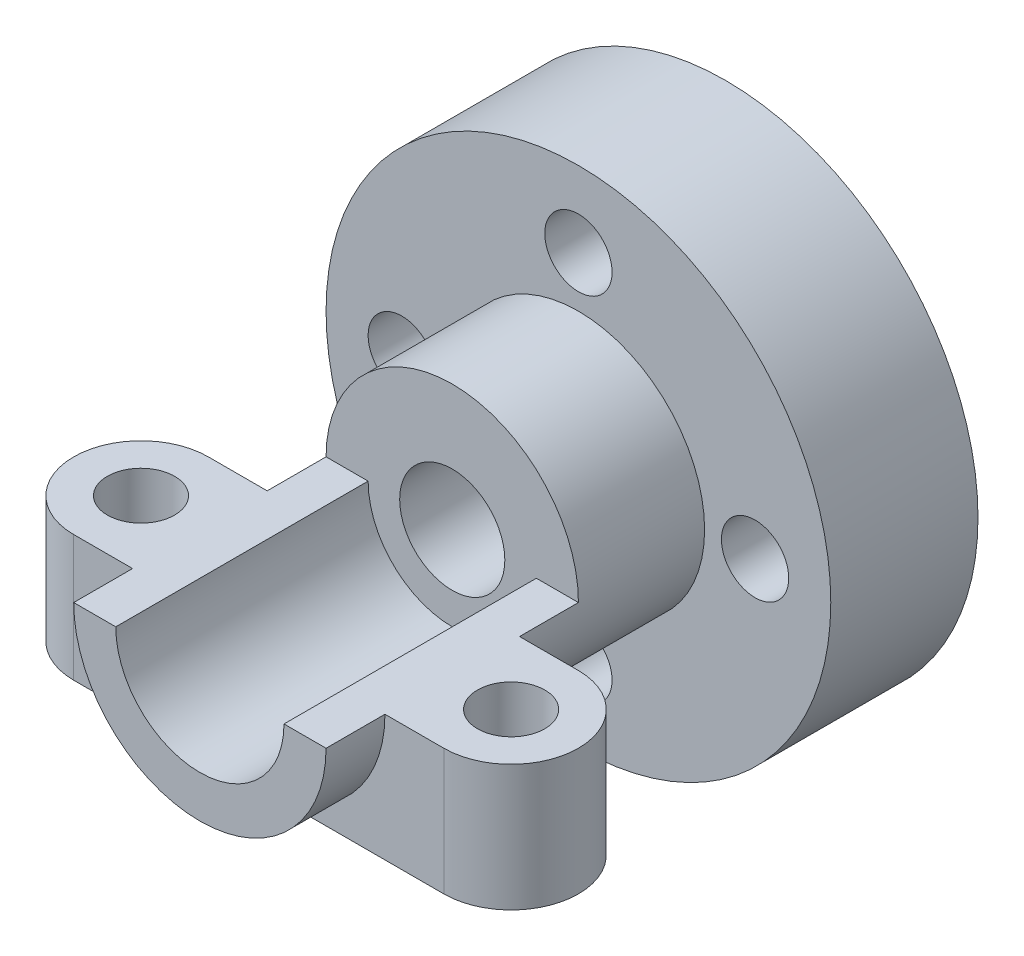
from build123d import *

# Parameters (mm, degrees)
BOSS_EXTRUDE1_DEPTH         = 125
SKETCH1_3_R                 = 12.5
BOSS_EXTRUDE2_DEPTH         = 65
SKETCH1_4_R                 = 60
SKETCH1_4_R_2               = 8
SKETCH1_4_R_3               = 30
BOSS_EXTRUDE3_DEPTH         = 35
BOSS_EXTRUDE4_START         = -46
BOSS_EXTRUDE4_DEPTH         = 32
FILLET1_RADIUS              = 16
FILLET1_LENGTH              = 30
F_16_0MM_DOWEL_HOLE1_D      = 16
FILLET1_OF_MIRROR1_2_RADIUS = 16
FILLET1_OF_MIRROR1_2_LENGTH = 30
SKETCH4_R                   = 55
CUT_EXTRUDE1_DEPTH          = 15


with BuildPart() as part:
    # Sketch1 → Boss-Extrude1 (new body)
    with BuildSketch(Plane.XY):
        with BuildLine():
            ThreePointArc((20, 0), (0, -20), (-20, 0))
            Line((-20, 0), (-30, 0))
            ThreePointArc((-30, 0), (0, -30), (30, 0))
            Line((30, 0), (20, 0))
        make_face()
    extrude(amount=BOSS_EXTRUDE1_DEPTH)

    # Sketch1<3> → Boss-Extrude2 (add)
    with BuildSketch(Plane.XY):
        with BuildLine():
            Line((-30, 0), (-20, 0))
            ThreePointArc((-20, 0), (0, -20), (20, 0))
            Line((20, 0), (30, 0))
            ThreePointArc((30, 0), (0, 30), (-30, 0))
        make_face()
        Circle(SKETCH1_3_R, mode=Mode.SUBTRACT)
    extrude(amount=BOSS_EXTRUDE2_DEPTH)

    # Sketch1<4> → Boss-Extrude3 (add)
    with BuildSketch(Plane.XY):
        Circle(SKETCH1_4_R)
        with Locations((0, 42)):
            Circle(SKETCH1_4_R_2, mode=Mode.SUBTRACT)
        with Locations((-42, 0)):
            Circle(SKETCH1_4_R_2, mode=Mode.SUBTRACT)
        with Locations((0, -42)):
            Circle(SKETCH1_4_R_2, mode=Mode.SUBTRACT)
        with Locations((42, 0)):
            Circle(SKETCH1_4_R_2, mode=Mode.SUBTRACT)
        Circle(SKETCH1_4_R_3, mode=Mode.SUBTRACT)
    extrude(amount=BOSS_EXTRUDE3_DEPTH)

    # Sketch2 → Boss-Extrude4 (add)
    with BuildSketch(Plane.XY.offset(125).offset(BOSS_EXTRUDE4_START)):
        with BuildLine():
            Line((60, 0), (30, 0))
            ThreePointArc((30, 0), (21.213203436, -21.213203436), (0, -30))
            Line((0, -30), (60, -30))
            Line((60, -30), (60, 0))
        make_face()
    boss_extrude4 = extrude(amount=BOSS_EXTRUDE4_DEPTH)

    # Fillet1: full round fillet: the end face becomes a half cylinder, R = half its width
    fillet1_face = Plane((60, -15, 95), x_dir=(0, -1, 0), z_dir=(1, 0, 0))  # on the end face: x along it, z out of the body
    fillet1_slab = fillet1_face.offset(-FILLET1_RADIUS / 2) * Box(FILLET1_LENGTH, 2 * FILLET1_RADIUS, FILLET1_RADIUS, mode=Mode.PRIVATE)  # the body's end, R deep
    fillet1_round = Plane((44, -15, 95), x_dir=(1, 0, 0), z_dir=(0, -1, 0)) * Cylinder(FILLET1_RADIUS, FILLET1_LENGTH, mode=Mode.PRIVATE)  # its axis R under the face
    add(fillet1_slab - fillet1_round, mode=Mode.SUBTRACT)

    # Ø16.0mm Dowel Hole1 (through all)
    with Locations(Plane(origin=(44, 0, 95), x_dir=(0, 0, 1), z_dir=(0, 1, 0))):
        with Locations((0, 0)):
            f_16_0mm_dowel_hole1 = Hole(F_16_0MM_DOWEL_HOLE1_D / 2)

    # Mirror1: Boss-Extrude4, Ø16.0mm Dowel Hole1 across plane
    add(boss_extrude4.mirror(Plane(origin=(0, 0, 0), x_dir=(0, 0, 1), z_dir=(1, 0, 0))))
    add(f_16_0mm_dowel_hole1.mirror(Plane(origin=(0, 0, 0), x_dir=(0, 0, 1), z_dir=(1, 0, 0))), mode=Mode.SUBTRACT)

    # Fillet1 of Mirror1 2: full round fillet: the end face becomes a half cylinder, R = half its width
    fillet1_of_mirror1_2_face = Plane((-60, -15, 95), x_dir=(0, -1, 0), z_dir=(-1, 0, 0))  # on the end face: x along it, z out of the body
    fillet1_of_mirror1_2_slab = fillet1_of_mirror1_2_face.offset(-FILLET1_OF_MIRROR1_2_RADIUS / 2) * Box(FILLET1_OF_MIRROR1_2_LENGTH, 2 * FILLET1_OF_MIRROR1_2_RADIUS, FILLET1_OF_MIRROR1_2_RADIUS, mode=Mode.PRIVATE)  # the body's end, R deep
    fillet1_of_mirror1_2_round = Plane((-44, -15, 95), x_dir=(-1, 0, 0), z_dir=(0, -1, 0)) * Cylinder(FILLET1_OF_MIRROR1_2_RADIUS, FILLET1_OF_MIRROR1_2_LENGTH, mode=Mode.PRIVATE)  # its axis R under the face
    add(fillet1_of_mirror1_2_slab - fillet1_of_mirror1_2_round, mode=Mode.SUBTRACT)

    # Sketch4 → Cut-Extrude1 (cut)
    with BuildSketch(Plane(origin=(0, 0, 0), x_dir=(-1, 0, 0), z_dir=(0, 0, -1))):
        Circle(SKETCH4_R)
    extrude(amount=-CUT_EXTRUDE1_DEPTH, mode=Mode.SUBTRACT)


solid = part.part
